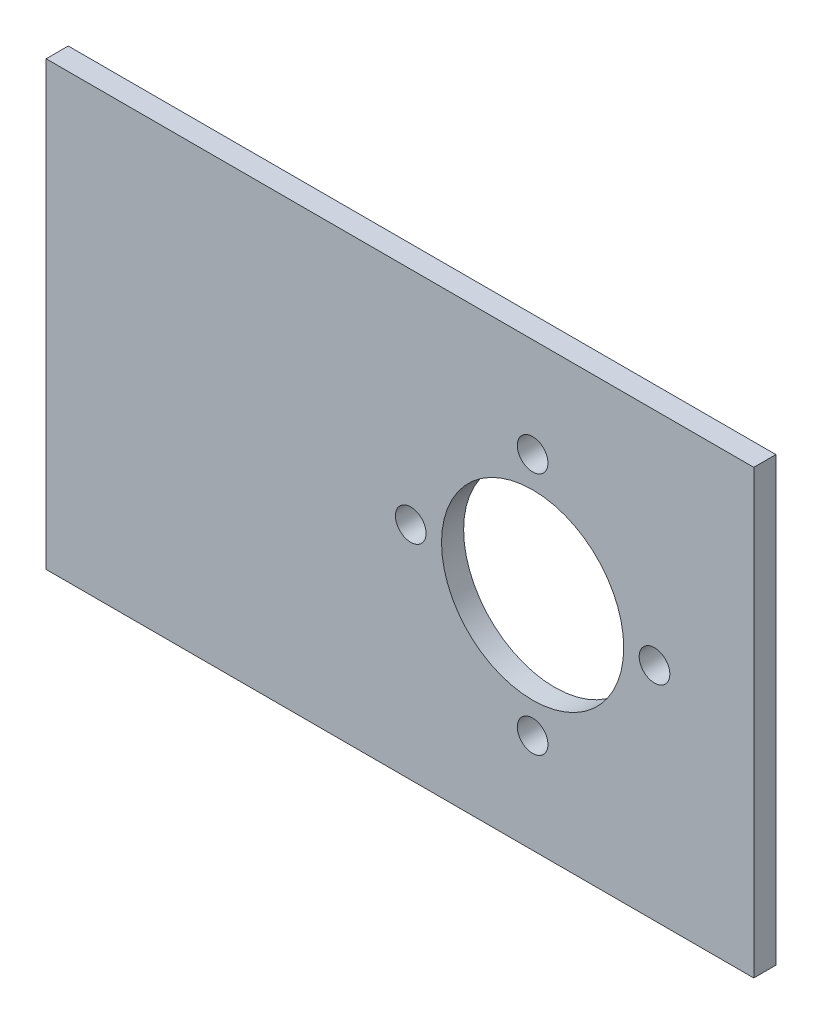
from build123d import *

# Parameters (mm, degrees)
SKETCH1_W           = 101.6
SKETCH1_H           = 63.5
SKETCH1_R           = 2.2
SKETCH1_R_2         = 13.081
BOSS_EXTRUDE1_DEPTH = 3.175


with BuildPart() as part:
    # Sketch1 → Boss-Extrude1 (new body)
    with BuildSketch(Plane.XY):
        with Locations((-19.05, 0)):
            Rectangle(SKETCH1_W, SKETCH1_H)
        with Locations((0, 17.5006)):
            Circle(SKETCH1_R, mode=Mode.SUBTRACT)
        with Locations((17.5006, 0)):
            Circle(SKETCH1_R, mode=Mode.SUBTRACT)
        with Locations((0, -17.5006)):
            Circle(SKETCH1_R, mode=Mode.SUBTRACT)
        with Locations((-17.5006, 0)):
            Circle(SKETCH1_R, mode=Mode.SUBTRACT)
        Circle(SKETCH1_R_2, mode=Mode.SUBTRACT)
    extrude(amount=BOSS_EXTRUDE1_DEPTH)


solid = part.part
